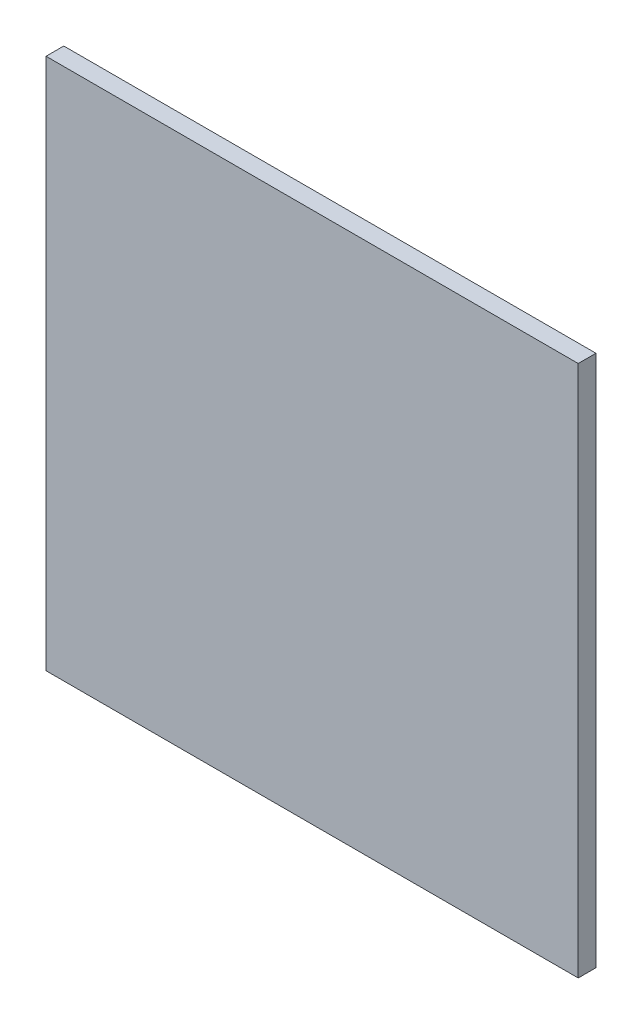
from build123d import *

# Parameters (mm, degrees)
SKETCH1_W           = 76.2
SKETCH1_H           = 76.2
BOSS_EXTRUDE1_DEPTH = 2.54


with BuildPart() as part:
    # Sketch1 → Boss-Extrude1 (new body)
    with BuildSketch(Plane.XY):
        with Locations((38.1, 38.1)):
            Rectangle(SKETCH1_W, SKETCH1_H)
    extrude(amount=BOSS_EXTRUDE1_DEPTH)


solid = part.part
